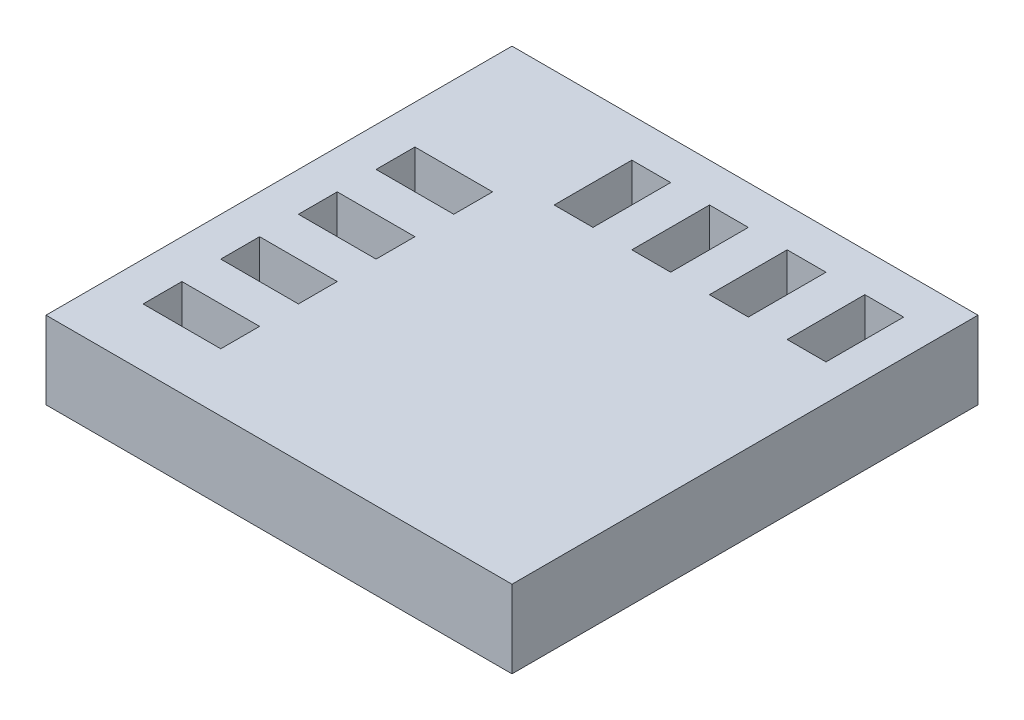
from build123d import *

# Parameters (mm, degrees)
SKETCH1_W           = 76.2
SKETCH1_H           = 76.2
SKETCH1_W_2         = 12.7
SKETCH1_H_2         = 6.35
SKETCH1_W_3         = 6.35
SKETCH1_H_3         = 12.7
BOSS_EXTRUDE1_DEPTH = 12.7


with BuildPart() as part:
    # Sketch1 → Boss-Extrude1 (new body)
    with BuildSketch(Plane(origin=(0, 0, 0), x_dir=(1, 0, 0), z_dir=(0, 1, 0))):
        Rectangle(SKETCH1_W, SKETCH1_H)
        with Locations((-25.4, 0)):
            Rectangle(SKETCH1_W_2, SKETCH1_H_2, mode=Mode.SUBTRACT)
        with Locations((-25.4, 12.7)):
            Rectangle(SKETCH1_W_2, SKETCH1_H_2, mode=Mode.SUBTRACT)
        with Locations((-25.4, -12.7)):
            Rectangle(SKETCH1_W_2, SKETCH1_H_2, mode=Mode.SUBTRACT)
        with Locations((-25.4, -25.4)):
            Rectangle(SKETCH1_W_2, SKETCH1_H_2, mode=Mode.SUBTRACT)
        with Locations((3.719341062, 25.4)):
            Rectangle(SKETCH1_W_3, SKETCH1_H_3, mode=Mode.SUBTRACT)
        with Locations((-8.980658938, 25.4)):
            Rectangle(SKETCH1_W_3, SKETCH1_H_3, mode=Mode.SUBTRACT)
        with Locations((16.419341062, 25.4)):
            Rectangle(SKETCH1_W_3, SKETCH1_H_3, mode=Mode.SUBTRACT)
        with Locations((29.119341062, 25.4)):
            Rectangle(SKETCH1_W_3, SKETCH1_H_3, mode=Mode.SUBTRACT)
    extrude(amount=BOSS_EXTRUDE1_DEPTH)


solid = part.part
